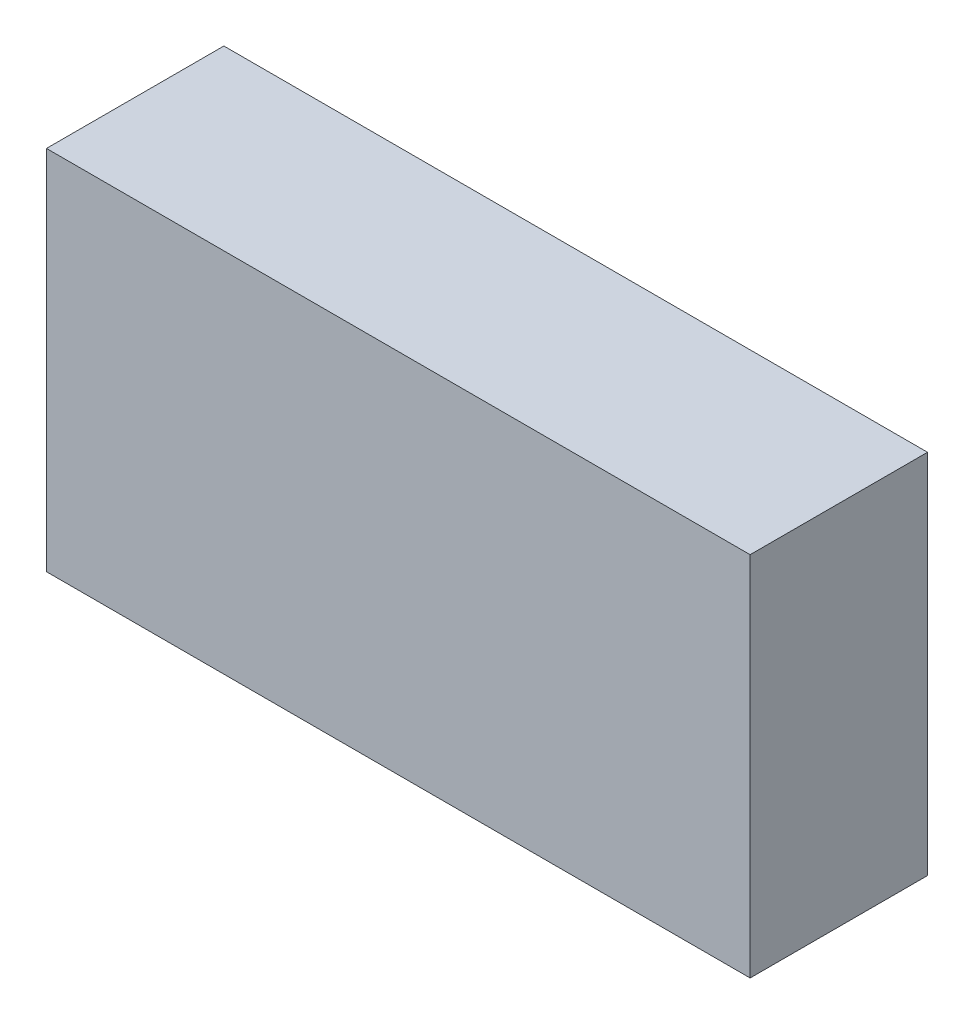
from build123d import *

# Parameters (mm, degrees)
SKETCH_1_W      = 238
SKETCH_1_H      = 124
EXTRUDE_1_DEPTH = 60


with BuildPart() as part:
    # 草图1 → 凸台-拉伸1 (new body)
    with BuildSketch(Plane.XY):
        with Locations((63.820512821, 13.512820513)):
            Rectangle(SKETCH_1_W, SKETCH_1_H)
    extrude(amount=EXTRUDE_1_DEPTH)


solid = part.part
